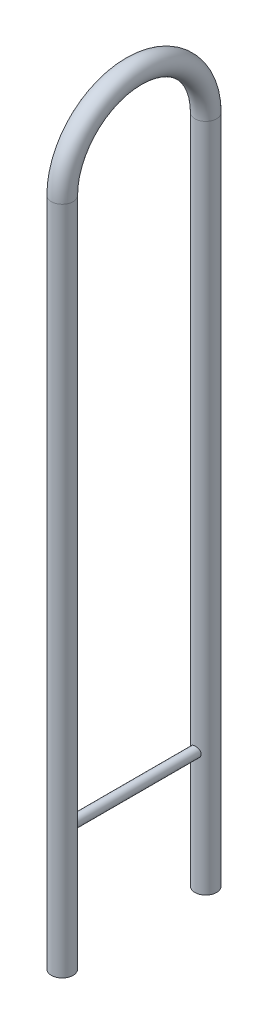
from build123d import *

# Parameters (mm, degrees)
SWEEP1_PROFILE_R = 13.589
SWEEP2_PROFILE_R = 6.35
SHELL1_T         = -1.524


with BuildPart() as part:
    # Sweep1: sweep along a path in Sketch2
    with BuildLine(Plane.YZ) as sweep1_path:
        Line((-838.2, 89.789), (0, 89.789))
        ThreePointArc((0, 89.789), (89.789, 0), (0, -89.789))
        Line((0, -89.789), (-838.2, -89.789))
    # Sweep1 profile (on start of the path) → Sweep1 (sweep)
    with BuildSketch(Plane(origin=(0, -838.2, 89.789), x_dir=(0, 0, 1), z_dir=(0, 1, 0))):
        Circle(SWEEP1_PROFILE_R)
    sweep(path=sweep1_path.line)

    # Sweep2: sweep along a path in Sketch2<3>
    with BuildLine(Plane.YZ) as sweep2_path:
        Line((-685.8, 89.789), (-685.8, -89.789))
    # Sweep2 profile (on start of the path) → Sweep2 (sweep)
    with BuildSketch(Plane(origin=(0, -685.8, 89.789), x_dir=(-1, 0, 0), z_dir=(0, 0, -1))):
        Circle(SWEEP2_PROFILE_R)
    sweep(path=sweep2_path.line)

    # Shell1
    shell1_openings = [part.faces().sort_by_distance(p)[0] for p in [
        (0, -838.2, -89.789),
        (0, -838.2, 89.789),
    ]]
    offset(amount=SHELL1_T, openings=shell1_openings, kind=Kind.INTERSECTION)


solid = part.part
